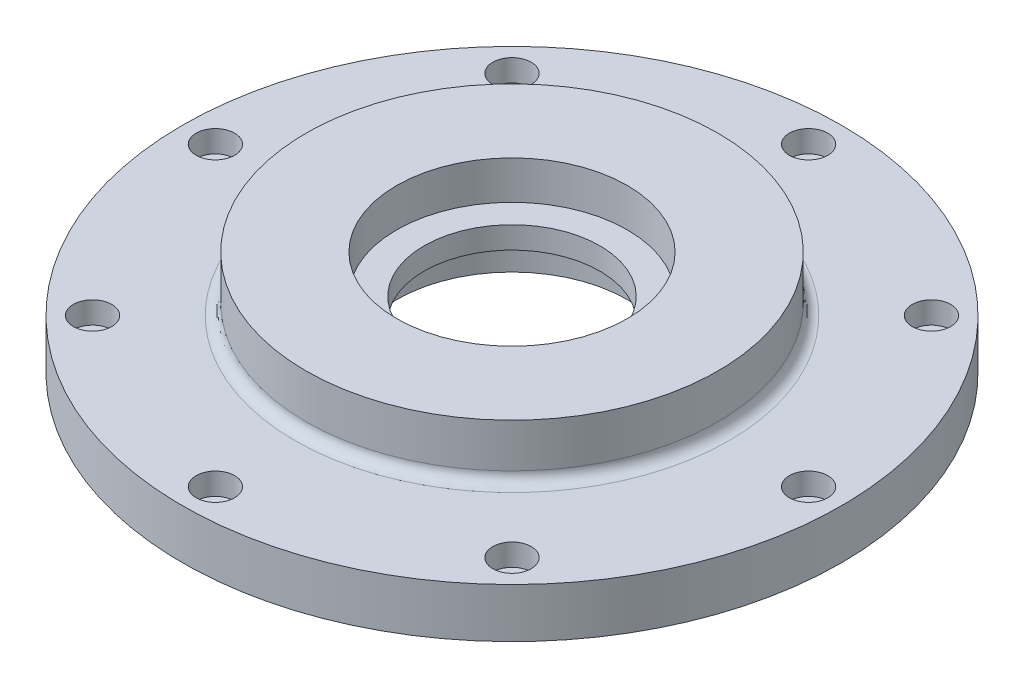
from build123d import *

# Parameters (mm, degrees)
SKETCH3_R          = 67.964535867
SKETCH3_R_2        = 37.5
CUT_EXTRUDE3_DEPTH = 10
SKETCH4_R          = 35.5
CUT_EXTRUDE4_DEPTH = 1
SKETCH6_R          = 2
CUT_EXTRUDE5_DEPTH = 10
SKETCH7_R          = 3.5
CUT_EXTRUDE6_DEPTH = 4
FILLET1_R          = 2


with BuildPart() as part:
    # Sketch1 → Revolve1 (revolve)
    with BuildSketch(Plane.XY):
        Polygon((-21, 11), (-60, 11), (-60, -8), (-21, -8), (-21, 0), (-16, 0), (-16, 4), (-21, 4), align=None)
    revolve(axis=Axis((0, 11, 0), (0, -1, 0)))

    # Sketch3 → Cut-Extrude3 (cut)
    with BuildSketch(Plane.XZ.offset(-11)):
        Circle(SKETCH3_R)
        with Locations(Location((0, 0, 0), (0, 0, 270))):
            Circle(SKETCH3_R_2, mode=Mode.SUBTRACT)
    extrude(amount=CUT_EXTRUDE3_DEPTH, mode=Mode.SUBTRACT)

    # Sketch4 → Cut-Extrude4 (cut)
    with BuildSketch(Plane.XZ.offset(8)):
        with Locations(Location((0, 0, 0), (0, 0, 270))):
            Circle(SKETCH4_R)
    extrude(amount=-CUT_EXTRUDE4_DEPTH, mode=Mode.SUBTRACT)

    # Sketch6 → Cut-Extrude5 (cut)
    with BuildSketch(Plane(origin=(0, 1, 0), x_dir=(1, 0, 0), z_dir=(0, 1, 0))):
        with Locations(Location((0, 54, 0), (0, 0, 270))):
            Circle(SKETCH6_R)
        with Locations(Location((38.183766184, 38.183766184, 0), (0, 0, 270))):
            Circle(SKETCH6_R)
        with Locations(Location((54, 0, 0), (0, 0, 270))):
            Circle(SKETCH6_R)
        with Locations(Location((38.183766184, -38.183766184, 0), (0, 0, 270))):
            Circle(SKETCH6_R)
        with Locations(Location((0, -54, 0), (0, 0, 270))):
            Circle(SKETCH6_R)
        with Locations(Location((-38.183766184, -38.183766184, 0), (0, 0, 270))):
            Circle(SKETCH6_R)
        with Locations(Location((-54, 0, 0), (0, 0, 270))):
            Circle(SKETCH6_R)
        with Locations(Location((-38.183766184, 38.183766184, 0), (0, 0, 270))):
            Circle(SKETCH6_R)
    extrude(amount=-CUT_EXTRUDE5_DEPTH, mode=Mode.SUBTRACT)

    # Sketch7 → Cut-Extrude6 (cut)
    with BuildSketch(Plane(origin=(0, 1, 0), x_dir=(1, 0, 0), z_dir=(0, 1, 0))):
        with Locations(Location((0, 54, 0), (0, 0, 270))):
            Circle(SKETCH7_R)
        with Locations(Location((38.183766184, 38.183766184, 0), (0, 0, 270))):
            Circle(SKETCH7_R)
        with Locations(Location((54, 0, 0), (0, 0, 270))):
            Circle(SKETCH7_R)
        with Locations(Location((38.183766184, -38.183766184, 0), (0, 0, 270))):
            Circle(SKETCH7_R)
        with Locations(Location((0, -54, 0), (0, 0, 270))):
            Circle(SKETCH7_R)
        with Locations(Location((-38.183766184, -38.183766184, 0), (0, 0, 270))):
            Circle(SKETCH7_R)
        with Locations(Location((-54, 0, 0), (0, 0, 270))):
            Circle(SKETCH7_R)
        with Locations(Location((-38.183766184, 38.183766184, 0), (0, 0, 270))):
            Circle(SKETCH7_R)
    extrude(amount=-CUT_EXTRUDE6_DEPTH, mode=Mode.SUBTRACT)

    # Fillet1
    fillet1_edges = [part.edges().sort_by_distance(p)[0] for p in [
        (0, 1, 37.5),
    ]]
    fillet(fillet1_edges, radius=FILLET1_R)


solid = part.part
